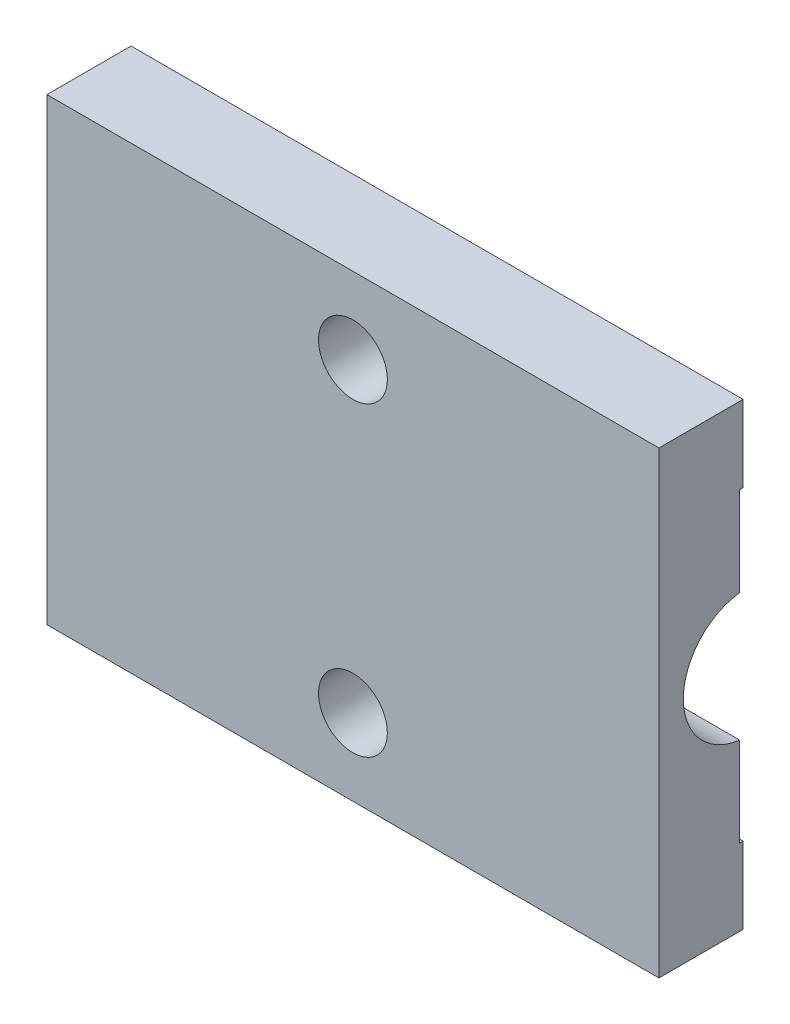
from build123d import *

# Parameters (mm, degrees)
SKETCH1_W            = 40
SKETCH1_H            = 30
BOSS_EXTRUDE1_DEPTH  = 5.5
SKETCH2_R            = 4.205
CUT_EXTRUDE1_DEPTH   = 44.072613109
M4_CLEARANCE_HOLE1_D = 4.5
SKETCH7_W            = 1.05
SKETCH7_H            = 20
CUT_EXTRUDE2_DEPTH   = 10


with BuildPart() as part:
    # Sketch1 → Boss-Extrude1 (new body)
    with BuildSketch(Plane.XY):
        Rectangle(SKETCH1_W, SKETCH1_H)
    extrude(amount=BOSS_EXTRUDE1_DEPTH)

    # Sketch2 → Cut-Extrude1 (cut, through all)
    with BuildSketch(Plane(origin=(20, 0, 0), x_dir=(0, 0, -1), z_dir=(1, 0, 0))):
        with Locations((0.3, 0)):
            Circle(SKETCH2_R)
    extrude(amount=-CUT_EXTRUDE1_DEPTH, mode=Mode.SUBTRACT)

    # M4 Clearance Hole1 (through all)
    with Locations(Plane.XY.offset(5.5)):
        with Locations((0, 10), (0, -10)):
            Hole(M4_CLEARANCE_HOLE1_D / 2)

    # Sketch7 → Cut-Extrude2 (cut)
    with BuildSketch(Plane(origin=(20, 0, 0), x_dir=(0, 0, -1), z_dir=(1, 0, 0))):
        with Locations((0.3, 0)):
            Rectangle(SKETCH7_W, SKETCH7_H)
    extrude(amount=-CUT_EXTRUDE2_DEPTH, mode=Mode.SUBTRACT)


solid = part.part
